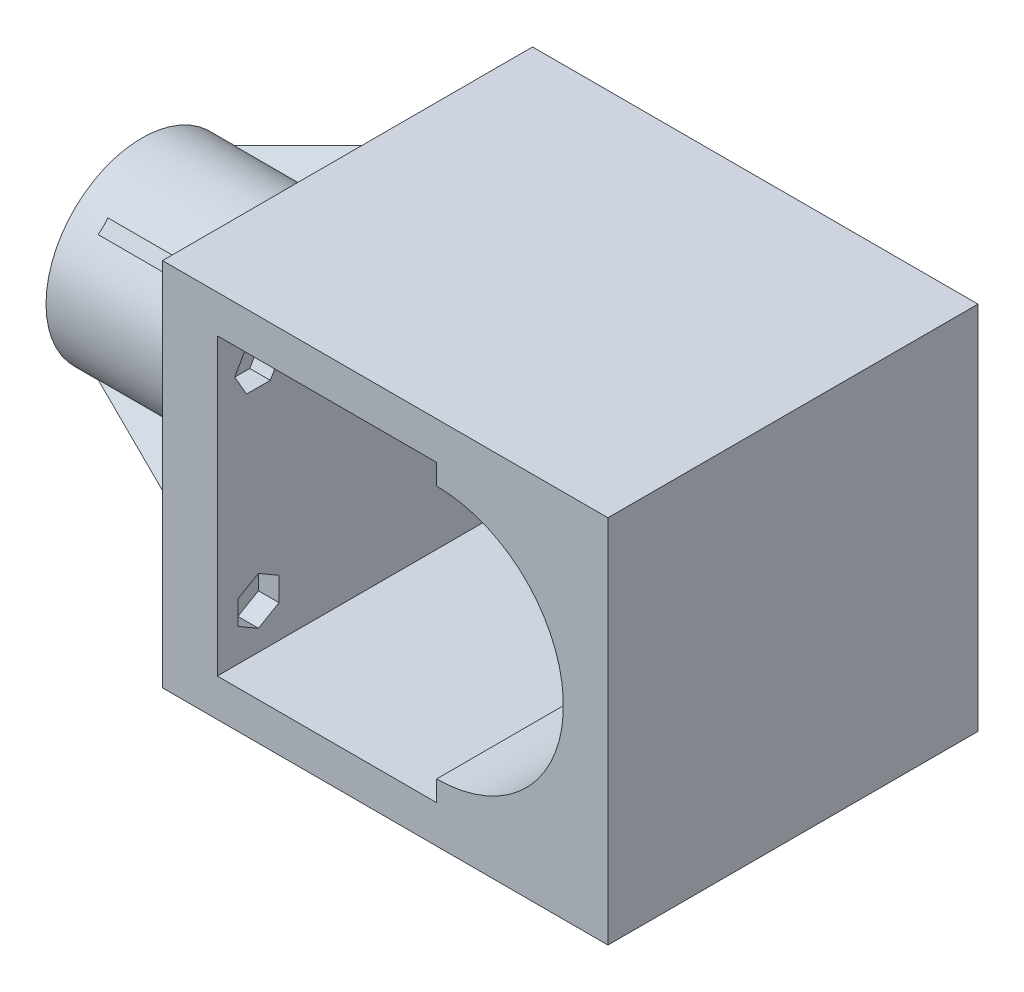
from build123d import *

# Parameters (mm, degrees)
BOSS_EXTRUDE1_DEPTH = 27
SKETCH10_R          = 14
BOSS_EXTRUDE5_DEPTH = 30
SKETCH2_R           = 10
CUT_EXTRUDE7_DEPTH  = 30
BOSS_EXTRUDE9_DEPTH = 1
CIRPATTERN1_COUNT   = 2
CIRPATTERN1_ANGLE   = 90
CUT_EXTRUDE8_DEPTH  = 28
CUT_EXTRUDE9_DEPTH  = 26
CUT_EXTRUDE10_DEPTH = 87.897928629
CUT_EXTRUDE11_DEPTH = 3


with BuildPart() as part:
    # Sketch1 → Boss-Extrude1 (new, symmetric)
    with BuildSketch(Plane(origin=(0, 0, 0), x_dir=(1, 0, 0), z_dir=(0, 1, 0))):
        Polygon((32.5, -27), (32.5, 27), (-32.5, 27), (-32.5, -27), (-20, -27), align=None)
    extrude(amount=BOSS_EXTRUDE1_DEPTH, both=True)

    # Sketch10 → Boss-Extrude5 (add)
    with BuildSketch(Plane(origin=(-32.5, 0, 0), x_dir=(0, 0, -1), z_dir=(1, 0, 0))):
        Circle(SKETCH10_R)
    extrude(amount=-BOSS_EXTRUDE5_DEPTH)

    # Sketch2 → Cut-Extrude7 (cut)
    with BuildSketch(Plane.ZY.offset(32.5)):
        with Locations(Location((0, 0, 0), (0, 0, 180))):
            Circle(SKETCH2_R)
    extrude(amount=CUT_EXTRUDE7_DEPTH, mode=Mode.SUBTRACT)

    # Sketch16 → Boss-Extrude9 (add, symmetric)
    with BuildSketch(Plane(origin=(0, 0, 0), x_dir=(-1, 0, 0), z_dir=(0, 0.7071067811865475, -0.7071067811865477))):
        Polygon((62.5, -12), (30, -12), (32.5, -26.063797676), align=None)
        Polygon((30, 12), (32.5, 26.063797676), (62.5, 12), align=None)
    boss_extrude9 = extrude(amount=BOSS_EXTRUDE9_DEPTH, both=True)

    # CirPattern1: Boss-Extrude9 ×2 about axis
    cirpattern1_axis = Axis((0, 0, 0), (1, 0, 0))
    for i in range(1, CIRPATTERN1_COUNT):
        add(boss_extrude9.rotate(cirpattern1_axis, i * CIRPATTERN1_ANGLE / (CIRPATTERN1_COUNT - 1)))

    # Sketch18 → Cut-Extrude8 (cut)
    with BuildSketch(Plane.XY.offset(27)):
        with BuildLine():
            Line((7.5, -18.5), (-2.5, -18.5))
            ThreePointArc((-2.5, -18.5), (-21, 0), (-2.5, 18.5))
            Line((-2.5, 18.5), (7.5, 18.5))
            ThreePointArc((7.5, 18.5), (26, 0), (7.5, -18.5))
        make_face()
    extrude(amount=-CUT_EXTRUDE8_DEPTH, mode=Mode.SUBTRACT)

    # Sketch19 → Cut-Extrude9 (cut)
    with BuildSketch(Plane(origin=(0, 0, -27), x_dir=(-1, 0, 0), z_dir=(0, 0, -1))):
        with BuildLine():
            Line((2.5, -17.5), (-7.5, -17.5))
            ThreePointArc((-7.5, -17.5), (-25, 0), (-7.5, 17.5))
            Line((-7.5, 17.5), (2.5, 17.5))
            ThreePointArc((2.5, 17.5), (20, 0), (2.5, -17.5))
        make_face()
    extrude(amount=-CUT_EXTRUDE9_DEPTH, mode=Mode.SUBTRACT)

    # Sketch20 → Cut-Extrude10 (cut, through all)
    with BuildSketch(Plane.XY.offset(27)):
        Polygon((-24.5, 21.5), (-24.5, -21.5), (7.5, -21.5), (7.5, -18.5), (7.5, 18.5), (7.5, 21.5), align=None)
    extrude(amount=-CUT_EXTRUDE10_DEPTH, mode=Mode.SUBTRACT)

    # Sketch22 → Cut-Extrude11 (cut)
    with BuildSketch(Plane(origin=(-24.5, 0, 0), x_dir=(0, 0, -1), z_dir=(1, 0, 0))):
        Polygon((18, -16.732050808), (21, -18.464101615), (24, -16.732050808), (24, -13.267949192), (21, -11.535898385), (18, -13.267949192), align=None)
        Polygon((-24, -16.732050808), (-21, -18.464101615), (-18, -16.732050808), (-18, -13.267949192), (-21, -11.535898385), (-24, -13.267949192), align=None)
        Polygon((-24.464101615, 15), (-22.732050808, 12), (-19.267949192, 12), (-17.535898385, 15), (-19.267949192, 18), (-22.732050808, 18), align=None)
        Polygon((18, 16.732050808), (18, 13.267949192), (21, 11.535898385), (24, 13.267949192), (24, 16.732050808), (21, 18.464101615), align=None)
    extrude(amount=-CUT_EXTRUDE11_DEPTH, mode=Mode.SUBTRACT)


solid = part.part
